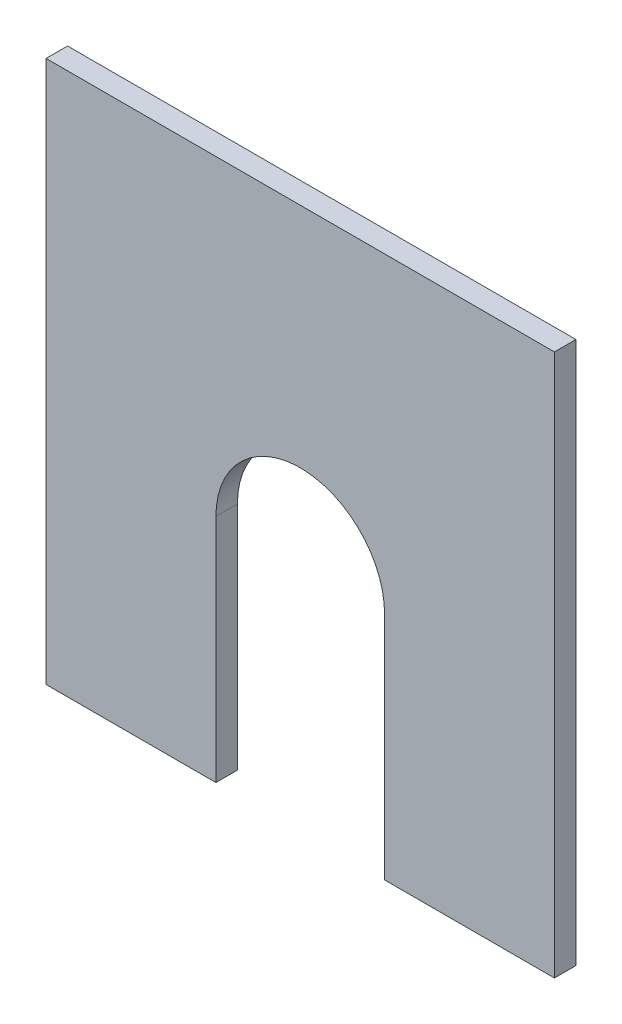
from build123d import *

# Parameters (mm, degrees)
SKETCH1_W           = 150
SKETCH1_H           = 160
BOSS_EXTRUDE1_DEPTH = 6.35
CUT_EXTRUDE1_REACH  = 111.842


with BuildPart() as part:
    # Sketch1 → Boss-Extrude1 (new body)
    with BuildSketch(Plane.XY):
        Rectangle(SKETCH1_W, SKETCH1_H)
    extrude(amount=BOSS_EXTRUDE1_DEPTH)

    # Sketch2 → Cut-Extrude1 (cut, up to next)
    with BuildSketch(Plane.XY.offset(6.35), mode=Mode.PRIVATE) as cut_extrude1_sk1:
        with BuildLine():
            Line((-24.89, -12), (-24.89, -80))
            Line((-24.89, -80), (24.89, -80))
            Line((24.89, -80), (24.89, -12))
            ThreePointArc((24.89, -12), (0, 12.89), (-24.89, -12))
        make_face()
    cut_extrude1_tool1 = extrude(cut_extrude1_sk1.sketch, amount=-CUT_EXTRUDE1_REACH, mode=Mode.PRIVATE) & part.part
    add(cut_extrude1_tool1.solids().sort_by_distance((0, -36.049464, 6.35))[0], mode=Mode.SUBTRACT)


solid = part.part
